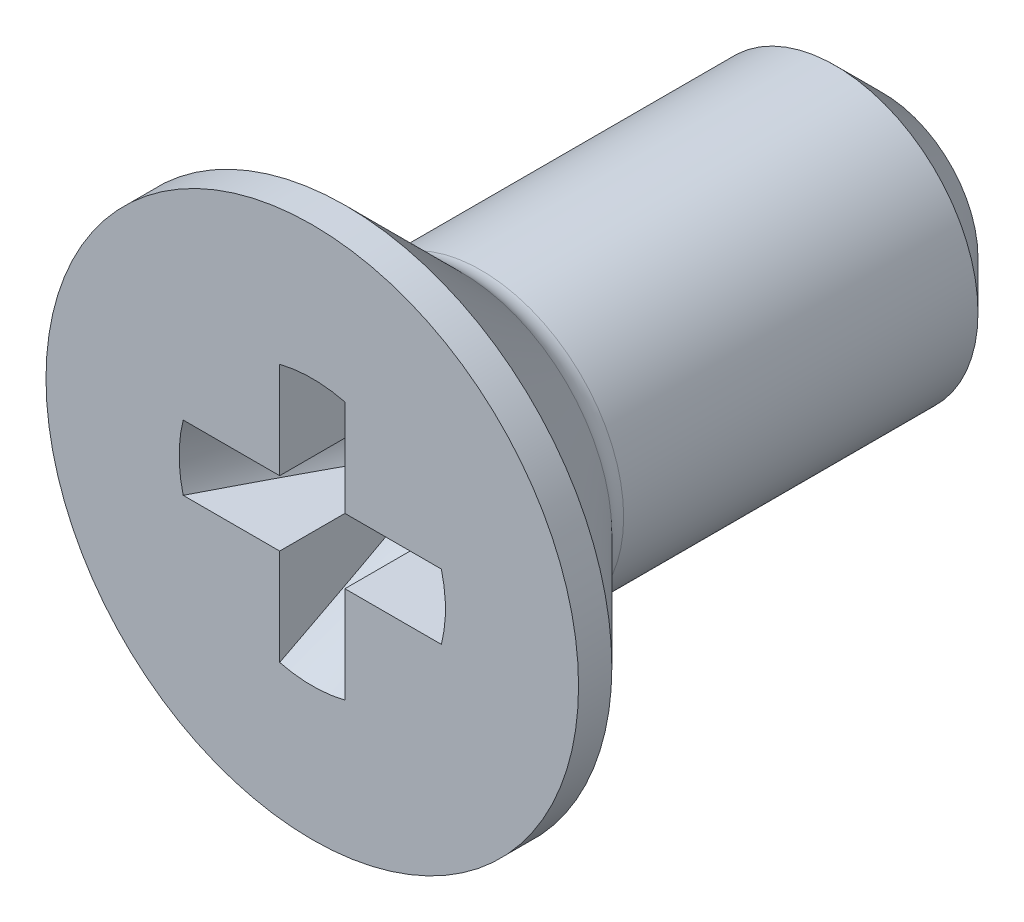
from build123d import *
from build123d.topology import SkipClean

# Parameters (mm, degrees)
CHAMFERROD_SIZE   = 0.5
CROSS_DEPTH       = 2.8
CIRPATTERN1_COUNT = 4
FILLET1_R         = 0.3


with BuildPart() as part:
    # Sketch1 → RevolveBase (revolve)
    with BuildSketch(Plane(origin=(0, 0, 0), x_dir=(0, 0, -1), z_dir=(1, 0, 0)), mode=Mode.PRIVATE) as revolvebase_sk:
        Polygon((0, 0), (0, 2.8), (0.35, 2.8), (1.65, 1.5), (6, 1.5), (6, 0), align=None)
    revolve(revolvebase_sk.sketch.rotate(Axis((0, 0, 0), (0, 0, -1)), 90), axis=Axis((0, 0, 0), (0, 0, -1)))

    # ChamferRod
    chamferrod_edges = [part.edges().sort_by_distance(p)[0] for p in [
        (-1.5, 0, -6),
    ]]
    chamfer(chamferrod_edges, length=CHAMFERROD_SIZE)

    # Sketch3 → Cross (cut)
    with BuildSketch(Plane.XY):
        with BuildLine():
            Line((-0.342946789, 0), (0.342946789, 0))
            Line((0.342946789, 0), (0.342946789, 1.357345756))
            ThreePointArc((0.342946789, 1.357345756), (0, 1.4), (-0.342946789, 1.357345756))
            Line((-0.342946789, 1.357345756), (-0.342946789, 0))
        make_face()
    cross = extrude(amount=-CROSS_DEPTH, mode=Mode.SUBTRACT)

    # CirPattern1: Cross ×4 about axis
    cirpattern1_axis = Axis((0, 0, 0), (0, 0, 1))
    for i in range(1, CIRPATTERN1_COUNT):
        add(cross.rotate(cirpattern1_axis, i * 360 / CIRPATTERN1_COUNT), mode=Mode.SUBTRACT)

    # Sketch5 → RevolveRod (revolve)
    with BuildSketch(Plane(origin=(0, 0, 0), x_dir=(0, 0, -1), z_dir=(1, 0, 0)), mode=Mode.PRIVATE) as revolverod_sk:
        Polygon((2.8, 0), (2.8, 1.9), (0, 1.9), (0, 1.4), (1.534352627, 0.635), (1.871988116, 0), align=None)
    revolve(revolverod_sk.sketch.rotate(Axis((0, 0, 0), (0, 0, -1)), 90), axis=Axis((0, 0, 0), (0, 0, -1)))

    # Sketch7 → CutRod (revolve, cut)
    with SkipClean():  # the faces are left unmerged after this step: merging them gives an invalid solid
        with BuildSketch(Plane(origin=(0, 0, 0), x_dir=(0, 0, -1), z_dir=(1, 0, 0)), mode=Mode.PRIVATE) as cutrod_sk:
            Polygon((-21.85, 25), (1.65, 1.5), (2.8, 1.5), (2.8, 25), align=None)
        revolve(cutrod_sk.sketch.rotate(Axis((0, 0, 0), (0, 0, -1)), 90), axis=Axis((0, 0, 0), (0, 0, -1)), mode=Mode.SUBTRACT)

    # Fillet1
    fillet1_edges = [part.edges().sort_by_distance(p)[0] for p in [
        (-1.5, 0, -1.65),
    ]]
    fillet(fillet1_edges, radius=FILLET1_R)


solid = part.part
